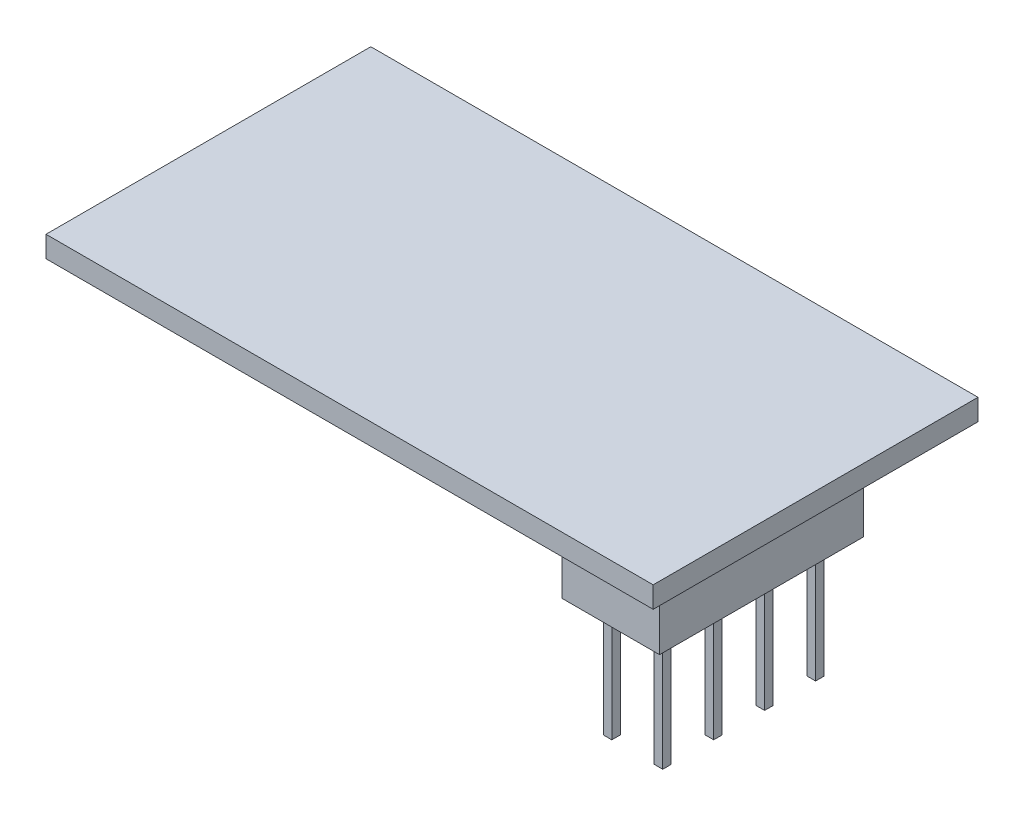
from build123d import *

# Parameters (mm, degrees)
SKETCH_1_W      = 28.6
SKETCH_1_H      = 15.3
EXTRUDE_1_DEPTH = 1
SKETCH_2_W      = 4.6
SKETCH_2_H      = 9.6
EXTRUDE_2_DEPTH = 2.5
SKETCH_3_W      = 0.4
SKETCH_3_H      = 0.4
EXTRUDE_3_DEPTH = 5.6


with BuildPart() as part:
    # 草图1 → 凸台-拉伸1 (new body)
    with BuildSketch(Plane(origin=(0, 0, 0), x_dir=(1, 0, 0), z_dir=(0, 1, 0))):
        Rectangle(SKETCH_1_W, SKETCH_1_H)
    extrude(amount=EXTRUDE_1_DEPTH)

    # 草图2 → 凸台-拉伸2 (add)
    with BuildSketch(Plane.XZ):
        with Locations((11.5, 2.05)):
            Rectangle(SKETCH_2_W, SKETCH_2_H)
    extrude(amount=EXTRUDE_2_DEPTH)

    # 草图3 → 凸台-拉伸3 (add)
    with BuildSketch(Plane.XZ.offset(2.5)):
        with Locations((12.75, 5.65)):
            Rectangle(SKETCH_3_W, SKETCH_3_H)
        with Locations((10.35, 5.65)):
            Rectangle(SKETCH_3_W, SKETCH_3_H)
        with Locations((12.75, 3.25)):
            Rectangle(SKETCH_3_W, SKETCH_3_H)
        with Locations((12.75, 0.85)):
            Rectangle(SKETCH_3_W, SKETCH_3_H)
        with Locations((12.75, -1.55)):
            Rectangle(SKETCH_3_W, SKETCH_3_H)
        with Locations((10.35, 3.25)):
            Rectangle(SKETCH_3_W, SKETCH_3_H)
        with Locations((10.35, 0.85)):
            Rectangle(SKETCH_3_W, SKETCH_3_H)
        with Locations((10.35, -1.55)):
            Rectangle(SKETCH_3_W, SKETCH_3_H)
    extrude(amount=EXTRUDE_3_DEPTH)


solid = part.part
